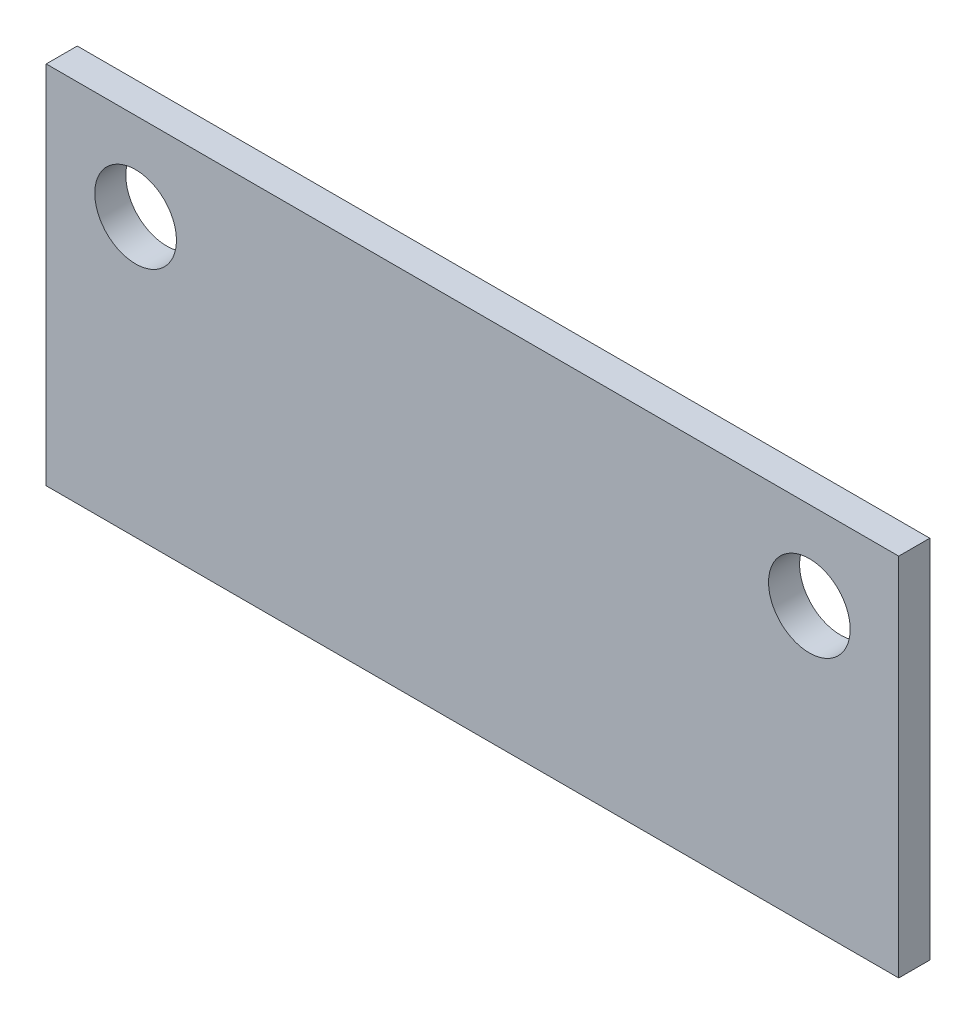
from build123d import *

# Parameters (mm, degrees)
SKETCH1_W           = 26.514449565
SKETCH1_H           = 11.363335528
SKETCH1_R           = 1.27
BOSS_EXTRUDE1_DEPTH = 0.9652


with BuildPart() as part:
    # Sketch1 → Boss-Extrude1 (new body)
    with BuildSketch(Plane.XY):
        with Locations((13.257224783, 5.681667764)):
            Rectangle(SKETCH1_W, SKETCH1_H)
        with Locations(Location((2.779724783, 8.636, 0), (0, 0, 180))):
            Circle(SKETCH1_R, mode=Mode.SUBTRACT)
        with Locations(Location((23.734724783, 8.636, 0), (0, 0, 180))):
            Circle(SKETCH1_R, mode=Mode.SUBTRACT)
    extrude(amount=BOSS_EXTRUDE1_DEPTH)


solid = part.part
